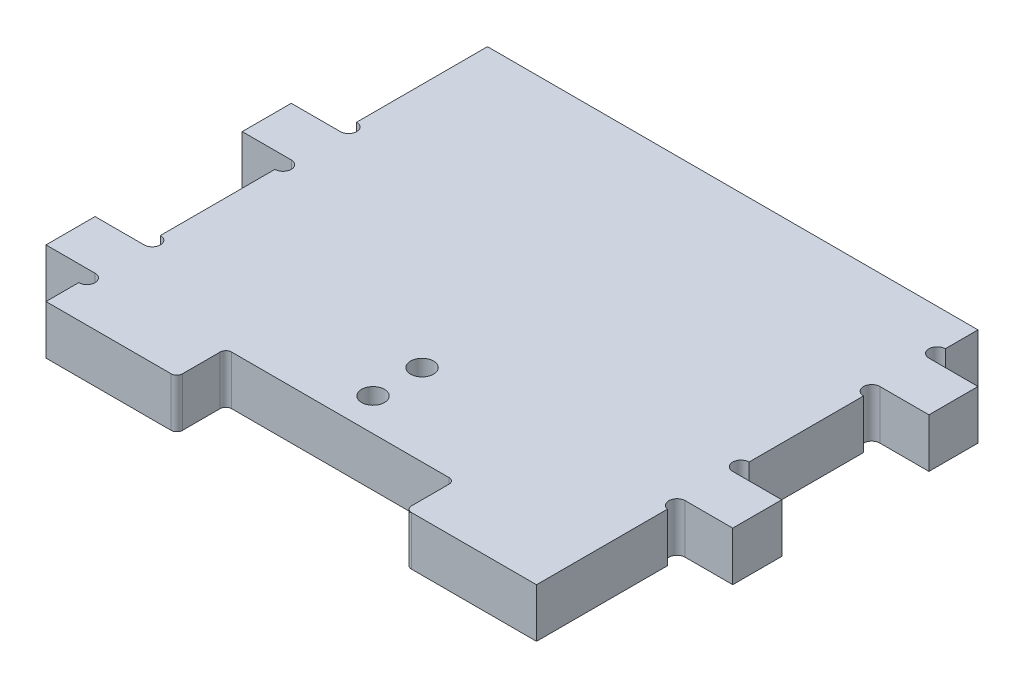
from build123d import *

# Parameters (mm, degrees)
BOSS_EXTRUDE1_DEPTH = 19.05
FILLET1_R           = 2.2225
SKETCH2_R           = 2.413
CUT_EXTRUDE1_DEPTH  = 272.420720469
SKETCH3_R           = 4.445
CUT_EXTRUDE2_DEPTH  = 6.35


with BuildPart() as part:
    # Sketch1 → Boss-Extrude1 (new body)
    with BuildSketch(Plane(origin=(0, 0, 0), x_dir=(1, 0, 0), z_dir=(0, 1, 0))):
        with BuildLine():
            Line((190.5, 171.45), (0, 171.45))
            Line((0, 171.45), (0, 120.65))
            ThreePointArc((0, 120.65), (3.175, 117.475), (0, 114.3))
            Line((0, 114.3), (-19.05, 114.3))
            Line((-19.05, 114.3), (-19.05, 95.25))
            Line((-19.05, 95.25), (0, 95.25))
            ThreePointArc((0, 95.25), (3.175, 92.075), (0, 88.9))
            Line((0, 88.9), (0, 44.45))
            ThreePointArc((0, 44.45), (3.175, 41.275), (0, 38.1))
            Line((0, 38.1), (-19.05, 38.1))
            Line((-19.05, 38.1), (-19.05, 19.05))
            Line((-19.05, 19.05), (0, 19.05))
            ThreePointArc((0, 19.05), (3.175, 15.875), (0, 12.7))
            Line((0, 12.7), (0, 0))
            Line((0, 0), (50.8, 0))
            Line((50.8, 0), (50.8, 19.05))
            Line((50.8, 19.05), (139.7, 19.05))
            Line((139.7, 19.05), (139.7, 0))
            Line((139.7, 0), (190.5, 0))
            Line((190.5, 0), (190.5, 50.855736572))
            ThreePointArc((190.5, 50.855736572), (187.931266017, 54.272458919), (191.092301163, 57.15))
            Line((191.092301163, 57.15), (209.55, 57.15))
            Line((209.55, 57.15), (209.55, 76.2))
            Line((209.55, 76.2), (190.5, 76.2))
            ThreePointArc((190.5, 76.2), (187.325, 79.375), (190.5, 82.55))
            Line((190.5, 82.55), (190.5, 127))
            ThreePointArc((190.5, 127), (187.325, 130.175), (190.5, 133.35))
            Line((190.5, 133.35), (209.55, 133.35))
            Line((209.55, 133.35), (209.55, 152.4))
            Line((209.55, 152.4), (190.5, 152.4))
            ThreePointArc((190.5, 152.4), (187.325, 155.575), (190.5, 158.75))
            Line((190.5, 158.75), (190.5, 171.45))
        make_face()
    extrude(amount=BOSS_EXTRUDE1_DEPTH)

    # Fillet1
    fillet1_edges = [part.edges().sort_by_distance(p)[0] for p in [
        (139.7, 9.525, 0),
        (139.7, 9.525, -19.05),
        (50.8, 9.525, -19.05),
        (50.8, 9.525, 0),
    ]]
    fillet(fillet1_edges, radius=FILLET1_R)

    # Sketch2 → Cut-Extrude1 (cut, through all)
    with BuildSketch(Plane.XZ):
        with Locations((95.25, -31.75)):
            Circle(SKETCH2_R)
        with Locations((95.25, -50.8)):
            Circle(SKETCH2_R)
    extrude(amount=-CUT_EXTRUDE1_DEPTH, mode=Mode.SUBTRACT)

    # Sketch3 → Cut-Extrude2 (cut)
    with BuildSketch(Plane(origin=(0, 19.05, 0), x_dir=(1, 0, 0), z_dir=(0, 1, 0))):
        with Locations((95.25, 31.75)):
            Circle(SKETCH3_R)
        with Locations((95.25, 50.8)):
            Circle(SKETCH3_R)
    extrude(amount=-CUT_EXTRUDE2_DEPTH, mode=Mode.SUBTRACT)


solid = part.part
